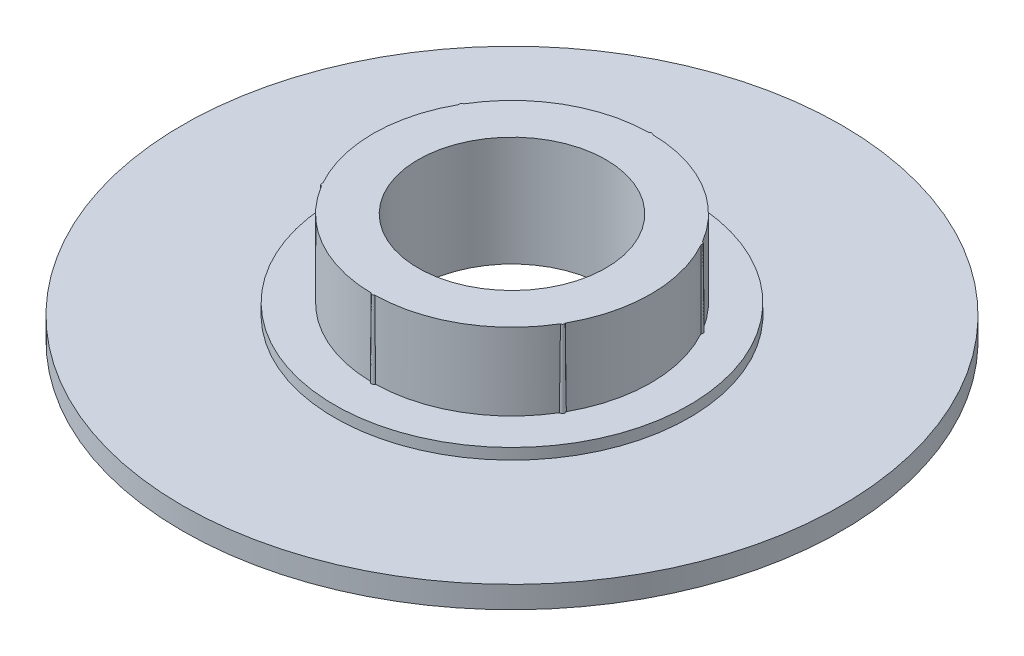
from build123d import *

# Parameters (mm, degrees)
SKETCH3_R                     = 0.25
BOSS_EXTRUDE1_DEPTH           = 7
BOSS_EXTRUDE1_DRAFT           = 0.5
BOSS_EXTRUDE1_PROFILE_2_DEPTH = 7
BOSS_EXTRUDE1_PROFILE_2_DRAFT = 0.5
BOSS_EXTRUDE1_PROFILE_3_DEPTH = 7
BOSS_EXTRUDE1_PROFILE_3_DRAFT = 0.5
BOSS_EXTRUDE1_PROFILE_4_DEPTH = 7
BOSS_EXTRUDE1_PROFILE_4_DRAFT = 0.5
BOSS_EXTRUDE1_PROFILE_5_DEPTH = 7
BOSS_EXTRUDE1_PROFILE_5_DRAFT = 0.5
BOSS_EXTRUDE1_PROFILE_6_DEPTH = 7
BOSS_EXTRUDE1_PROFILE_6_DRAFT = 0.5


with BuildPart() as part:
    # Sketch2 → Revolve1 (revolve)
    with BuildSketch(Plane.XY, mode=Mode.PRIVATE) as revolve1_sk:
        Polygon((-8.55, 0), (-30, 0), (-30, 2), (-16.15, 2), (-16.15, 3), (-12.65, 3), (-12.65, 10), (-8.55, 10), align=None)
    revolve(revolve1_sk.sketch.rotate(Axis((0, 0, 0), (0, 1, 0)), 270), axis=Axis((0, 0, 0), (0, 1, 0)))


with BuildPart() as boss_extrude1_tool:
    # Sketch3 → Boss-Extrude1 (with draft: the straight prism first)
    with BuildSketch(Plane(origin=(0, 3, 0), x_dir=(1, 0, 0), z_dir=(0, 1, 0))):
        with Locations((0, 12.55)):
            Circle(SKETCH3_R)
    extrude(amount=BOSS_EXTRUDE1_DEPTH)
    # Boss-Extrude1: the draft: its side faces are tilted about the plane it starts from
    boss_extrude1_sides = [boss_extrude1_tool.faces().sort_by_distance(p)[0] for p in [
        (-0.25, 6.5, -12.55),
    ]]
    draft(boss_extrude1_sides, Plane(origin=(0, 3, 0), x_dir=(1, 0, 0), z_dir=(0, 1, 0)), BOSS_EXTRUDE1_DRAFT)


with BuildPart() as part_1:
    add(part.part)

    # Boss-Extrude1: add boss_extrude1_tool
    add(boss_extrude1_tool.part)


with BuildPart() as boss_extrude1_profile_2_tool:
    # Sketch3 → Boss-Extrude1 profile 2 (with draft: the straight prism first)
    with BuildSketch(Plane(origin=(0, 3, 0), x_dir=(1, 0, 0), z_dir=(0, 1, 0))):
        with Locations((10.868618817, 6.275)):
            Circle(SKETCH3_R)
    extrude(amount=BOSS_EXTRUDE1_PROFILE_2_DEPTH)
    # Boss-Extrude1 profile 2: the draft: its side faces are tilted about the plane it starts from
    boss_extrude1_profile_2_sides = [boss_extrude1_profile_2_tool.faces().sort_by_distance(p)[0] for p in [
        (10.618618817, 6.5, -6.275),
    ]]
    draft(boss_extrude1_profile_2_sides, Plane(origin=(0, 3, 0), x_dir=(1, 0, 0), z_dir=(0, 1, 0)), BOSS_EXTRUDE1_PROFILE_2_DRAFT)


with BuildPart() as part_2:
    add(part_1.part)

    # Boss-Extrude1 profile 2: add boss_extrude1_profile_2_tool
    add(boss_extrude1_profile_2_tool.part)


with BuildPart() as boss_extrude1_profile_3_tool:
    # Sketch3 → Boss-Extrude1 profile 3 (with draft: the straight prism first)
    with BuildSketch(Plane(origin=(0, 3, 0), x_dir=(1, 0, 0), z_dir=(0, 1, 0))):
        with Locations((10.868618817, -6.275)):
            Circle(SKETCH3_R)
    extrude(amount=BOSS_EXTRUDE1_PROFILE_3_DEPTH)
    # Boss-Extrude1 profile 3: the draft: its side faces are tilted about the plane it starts from
    boss_extrude1_profile_3_sides = [boss_extrude1_profile_3_tool.faces().sort_by_distance(p)[0] for p in [
        (10.618618817, 6.5, 6.275),
    ]]
    draft(boss_extrude1_profile_3_sides, Plane(origin=(0, 3, 0), x_dir=(1, 0, 0), z_dir=(0, 1, 0)), BOSS_EXTRUDE1_PROFILE_3_DRAFT)


with BuildPart() as part_3:
    add(part_2.part)

    # Boss-Extrude1 profile 3: add boss_extrude1_profile_3_tool
    add(boss_extrude1_profile_3_tool.part)


with BuildPart() as boss_extrude1_profile_4_tool:
    # Sketch3 → Boss-Extrude1 profile 4 (with draft: the straight prism first)
    with BuildSketch(Plane(origin=(0, 3, 0), x_dir=(1, 0, 0), z_dir=(0, 1, 0))):
        with Locations((0, -12.55)):
            Circle(SKETCH3_R)
    extrude(amount=BOSS_EXTRUDE1_PROFILE_4_DEPTH)
    # Boss-Extrude1 profile 4: the draft: its side faces are tilted about the plane it starts from
    boss_extrude1_profile_4_sides = [boss_extrude1_profile_4_tool.faces().sort_by_distance(p)[0] for p in [
        (-0.25, 6.5, 12.55),
    ]]
    draft(boss_extrude1_profile_4_sides, Plane(origin=(0, 3, 0), x_dir=(1, 0, 0), z_dir=(0, 1, 0)), BOSS_EXTRUDE1_PROFILE_4_DRAFT)


with BuildPart() as part_4:
    add(part_3.part)

    # Boss-Extrude1 profile 4: add boss_extrude1_profile_4_tool
    add(boss_extrude1_profile_4_tool.part)


with BuildPart() as boss_extrude1_profile_5_tool:
    # Sketch3 → Boss-Extrude1 profile 5 (with draft: the straight prism first)
    with BuildSketch(Plane(origin=(0, 3, 0), x_dir=(1, 0, 0), z_dir=(0, 1, 0))):
        with Locations((-10.868618817, -6.275)):
            Circle(SKETCH3_R)
    extrude(amount=BOSS_EXTRUDE1_PROFILE_5_DEPTH)
    # Boss-Extrude1 profile 5: the draft: its side faces are tilted about the plane it starts from
    boss_extrude1_profile_5_sides = [boss_extrude1_profile_5_tool.faces().sort_by_distance(p)[0] for p in [
        (-11.118618817, 6.5, 6.275),
    ]]
    draft(boss_extrude1_profile_5_sides, Plane(origin=(0, 3, 0), x_dir=(1, 0, 0), z_dir=(0, 1, 0)), BOSS_EXTRUDE1_PROFILE_5_DRAFT)


with BuildPart() as part_5:
    add(part_4.part)

    # Boss-Extrude1 profile 5: add boss_extrude1_profile_5_tool
    add(boss_extrude1_profile_5_tool.part)


with BuildPart() as boss_extrude1_profile_6_tool:
    # Sketch3 → Boss-Extrude1 profile 6 (with draft: the straight prism first)
    with BuildSketch(Plane(origin=(0, 3, 0), x_dir=(1, 0, 0), z_dir=(0, 1, 0))):
        with Locations((-10.868618817, 6.275)):
            Circle(SKETCH3_R)
    extrude(amount=BOSS_EXTRUDE1_PROFILE_6_DEPTH)
    # Boss-Extrude1 profile 6: the draft: its side faces are tilted about the plane it starts from
    boss_extrude1_profile_6_sides = [boss_extrude1_profile_6_tool.faces().sort_by_distance(p)[0] for p in [
        (-11.118618817, 6.5, -6.275),
    ]]
    draft(boss_extrude1_profile_6_sides, Plane(origin=(0, 3, 0), x_dir=(1, 0, 0), z_dir=(0, 1, 0)), BOSS_EXTRUDE1_PROFILE_6_DRAFT)


with BuildPart() as part_6:
    add(part_5.part)

    # Boss-Extrude1 profile 6: add boss_extrude1_profile_6_tool
    add(boss_extrude1_profile_6_tool.part)


solid = part_6.part
